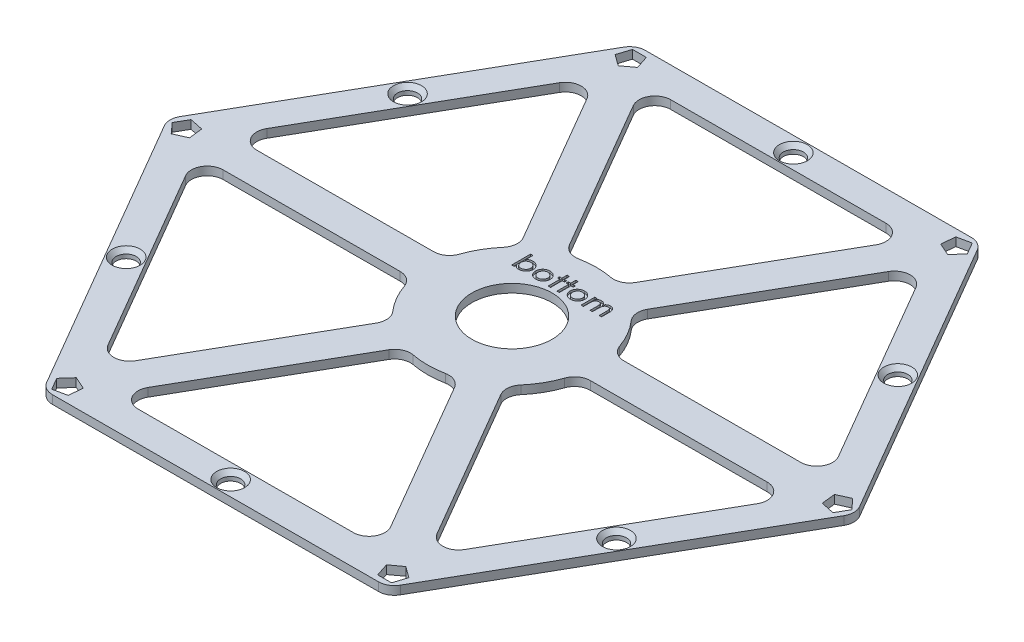
from build123d import *

# Parameters (mm, degrees)
SKETCH1_R           = 1.9
BOSS_EXTRUDE1_DEPTH = 1.6
FILLET1_R           = 3
FILLET2_R           = 3
SKETCH3_R           = 7.6
CUT_EXTRUDE1_DEPTH  = 10
CUT_EXTRUDE2_DEPTH  = 0.4
CHAMFER1_SIZE       = 0.75
CHAMFER1_SIZE2      = 0.832959386
SCALE1_SCALE        = 1.15


with BuildPart() as part:
    # Sketch1 → Boss-Extrude1 (new body)
    with BuildSketch(Plane(origin=(0, 0, 0), x_dir=(1, 0, 0), z_dir=(0, 1, 0))):
        Polygon((-32.670459977, 56.192891409), (-64.999701461, -0.197002589), (-32.329241484, -56.389893998), (32.670459977, -56.192891409), (64.999701461, 0.197002589), (32.329241484, 56.389893998), align=None)
        with Locations(Location((-46.355761236, 26.576510309, 0), (0, 0, 270))):
            Circle(SKETCH1_R, mode=Mode.SUBTRACT)
        with Locations(Location((-0.161947547, 53.433521997, 0), (0, 0, 270))):
            Circle(SKETCH1_R, mode=Mode.SUBTRACT)
        with Locations(Location((46.19381369, 26.857011688, 0), (0, 0, 270))):
            Circle(SKETCH1_R, mode=Mode.SUBTRACT)
        with Locations(Location((46.355761236, -26.576510309, 0), (0, 0, 270))):
            Circle(SKETCH1_R, mode=Mode.SUBTRACT)
        with Locations(Location((0.161947547, -53.433521997, 0), (0, 0, 270))):
            Circle(SKETCH1_R, mode=Mode.SUBTRACT)
        with Locations(Location((-46.19381369, -26.857011688, 0), (0, 0, 270))):
            Circle(SKETCH1_R, mode=Mode.SUBTRACT)
        with BuildLine():
            Line((-31.193440085, 47.277250649), (-56.559443422, 3.032901767))
            Line((-56.559443422, 3.032901767), (-15.685493875, 3.156783473))
            ThreePointArc((-15.685493875, 3.156783473), (-13.880589292, 7.957967134), (-10.649180608, 11.941312842))
            Line((-10.649180608, 11.941312842), (-31.193440085, 47.277250649))
        make_face(mode=Mode.SUBTRACT)
        with BuildLine():
            Line((-56.540020126, -3.375686221), (-30.906291689, -47.465463944))
            Line((-30.906291689, -47.465463944), (-10.576601619, -12.00564443))
            ThreePointArc((-10.576601619, -12.00564443), (-13.832096347, -8.041959379), (-15.666070579, -3.251804515))
            Line((-15.666070579, -3.251804515), (-56.540020126, -3.375686221))
        make_face(mode=Mode.SUBTRACT)
        with BuildLine():
            Line((-25.346580041, -50.65293687), (25.653151733, -50.498365711))
            Line((25.653151733, -50.498365711), (5.108892256, -15.162427903))
            ThreePointArc((5.108892256, -15.162427903), (0.048492945, -15.999926513), (-5.016889971, -15.193117357))
            Line((-5.016889971, -15.193117357), (-25.346580041, -50.65293687))
        make_face(mode=Mode.SUBTRACT)
        with BuildLine():
            Line((31.193440085, -47.277250649), (56.559443422, -3.032901767))
            Line((56.559443422, -3.032901767), (15.685493875, -3.156783473))
            ThreePointArc((15.685493875, -3.156783473), (13.880589292, -7.957967134), (10.649180608, -11.941312842))
            Line((10.649180608, -11.941312842), (31.193440085, -47.277250649))
        make_face(mode=Mode.SUBTRACT)
        with BuildLine():
            Line((56.540020126, 3.375686221), (30.906291689, 47.465463944))
            Line((30.906291689, 47.465463944), (10.576601619, 12.00564443))
            ThreePointArc((10.576601619, 12.00564443), (13.832096347, 8.041959379), (15.666070579, 3.251804515))
            Line((15.666070579, 3.251804515), (56.540020126, 3.375686221))
        make_face(mode=Mode.SUBTRACT)
        with BuildLine():
            Line((25.346580041, 50.65293687), (-25.653151733, 50.498365711))
            Line((-25.653151733, 50.498365711), (-5.108892256, 15.162427903))
            ThreePointArc((-5.108892256, 15.162427903), (-0.048492945, 15.999926513), (5.016889971, 15.193117357))
            Line((5.016889971, 15.193117357), (25.346580041, 50.65293687))
        make_face(mode=Mode.SUBTRACT)
        Polygon((28.764451985, 52.408726504), (31.157091964, 51.352131998), (32.90133947, 53.301162184), (31.586703733, 55.562323589), (29.029966659, 55.010768007), align=None, mode=Mode.SUBTRACT)
        Polygon((-31.00506254, 51.115109397), (-28.893704867, 52.658899148), (-29.709490768, 55.143976891), (-32.325031855, 55.136049649), (-33.125739246, 52.646072601), align=None, mode=Mode.SUBTRACT)
        Polygon((59.769514525, 1.293617108), (60.050796831, -1.30676715), (62.610830237, -1.842814707), (63.911735588, 0.42627394), (62.155705905, 2.364695405), align=None, mode=Mode.SUBTRACT)
        Polygon((31.00506254, -51.115109397), (28.893704867, -52.658899148), (29.709490768, -55.143976891), (32.325031855, -55.136049649), (33.125739246, -52.646072601), align=None, mode=Mode.SUBTRACT)
        Polygon((-28.764451985, -52.408726504), (-31.157091964, -51.352131998), (-32.90133947, -53.301162184), (-31.586703733, -55.562323589), (-29.029966659, -55.010768007), align=None, mode=Mode.SUBTRACT)
        Polygon((-59.769514525, -1.293617108), (-60.050796831, 1.30676715), (-62.610830237, 1.842814707), (-63.911735588, -0.42627394), (-62.155705905, -2.364695405), align=None, mode=Mode.SUBTRACT)
    extrude(amount=BOSS_EXTRUDE1_DEPTH)

    # Fillet1
    fillet1_edges = [part.edges().sort_by_distance(p)[0] for p in [
        (32.329241484, 0.8, -56.389893998),
        (64.999701461, 0.8, -0.197002589),
        (32.670459977, 0.8, 56.192891409),
        (-32.329241484, 0.8, 56.389893998),
        (-64.999701461, 0.8, 0.197002589),
        (-32.670459977, 0.8, -56.192891409),
    ]]
    fillet(fillet1_edges, radius=FILLET1_R)

    # Fillet2
    fillet2_edges = [part.edges().sort_by_distance(p)[0] for p in [
        (-25.653151733, 0.8, -50.498365711),
        (-5.108892256, 0.8, -15.162427903),
        (5.016889971, 0.8, -15.193117357),
        (25.346580041, 0.8, -50.65293687),
        (30.906291689, 0.8, -47.465463944),
        (10.576601619, 0.8, -12.00564443),
        (15.666070579, 0.8, -3.251804515),
        (56.540020126, 0.8, -3.375686221),
        (56.559443422, 0.8, 3.032901767),
        (15.685493875, 0.8, 3.156783473),
        (10.649180608, 0.8, 11.941312842),
        (31.193440085, 0.8, 47.277250649),
        (25.653151733, 0.8, 50.498365711),
        (5.108892256, 0.8, 15.162427903),
        (-5.016889971, 0.8, 15.193117357),
        (-25.346580041, 0.8, 50.65293687),
        (-10.649180608, 0.8, -11.941312842),
        (-31.193440085, 0.8, -47.277250649),
        (-30.906291689, 0.8, 47.465463944),
        (-10.576601619, 0.8, 12.00564443),
        (-15.666070579, 0.8, 3.251804515),
        (-56.540020126, 0.8, 3.375686221),
        (-56.559443422, 0.8, -3.032901767),
        (-15.685493875, 0.8, -3.156783473),
    ]]
    fillet(fillet2_edges, radius=FILLET2_R)

    # Sketch3 → Cut-Extrude1 (cut)
    with BuildSketch(Plane(origin=(0, 3.6, 0), x_dir=(1, 0, 0), z_dir=(0, 1, 0))):
        with Locations(Location((0, 0, 0), (0, 0, 270))):
            Circle(SKETCH3_R)
    extrude(amount=-CUT_EXTRUDE1_DEPTH, mode=Mode.SUBTRACT)

    # Sketch4 → Cut-Extrude2 (cut)
    # profile 1 of 6: a face of its own
    with BuildSketch(Plane(origin=(0, 1.6, 0), x_dir=(1, 0, 0), z_dir=(0, 1, 0))):
        with BuildLine():
            Line((-8.411608084, 8.345898604), (-8.411608084, 11.935642194))
            Line((-8.411608084, 11.935642194), (-7.962890136, 11.935642194))
            Line((-7.962890136, 11.935642194), (-7.962890136, 10.494135784))
            add(Edge.make_bspline(
                [(-7.962890136, 10.494135784), (-7.955236413, 10.514016076), (-7.940050548, 10.553460861), (-7.908001003, 10.608137128), (-7.872828628, 10.660474453), (-7.8305456, 10.70829229), (-7.783899458, 10.75350831), (-7.730525769, 10.793762374), (-7.673098726, 10.832450824), (-7.587400929, 10.876262859), (-7.474461069, 10.924327186), (-7.331016198, 10.963509367), (-7.18208645, 10.989512185), (-7.080524486, 10.992047952), (-7.028995905, 10.993334501)],
                knots=[0, 0, 0, 0, 0.680701944, 1.350590845, 2.022856059, 2.696285514, 3.389369315, 4.098573498, 4.833009766, 5.602602626, 7.175179895, 8.752393662, 10.352291167, 12, 12, 12, 12], degree=3))
            add(Edge.make_bspline(
                [(-7.028995905, 10.993334501), (-6.9805481, 10.992196958), (-6.885374184, 10.989962295), (-6.74580311, 10.970117535), (-6.611662578, 10.939920218), (-6.483880558, 10.895168673), (-6.361338558, 10.839080896), (-6.245582509, 10.768876522), (-6.134811002, 10.687483128), (-6.032176045, 10.593780646), (-5.938058286, 10.49244227), (-5.855451001, 10.384793184), (-5.786022677, 10.272358076), (-5.728275465, 10.155681587), (-5.684204409, 10.03402511), (-5.652558569, 9.907663073), (-5.63309031, 9.776793107), (-5.630743407, 9.687912418), (-5.629556802, 9.642973925)],
                knots=[0, 0, 0, 0, 1.074668416, 2.111146229, 3.122705793, 4.121647212, 5.110247569, 6.108286401, 7.120763069, 8.156293076, 9.187671081, 10.186679824, 11.162571933, 12.115944014, 13.070894994, 14.028209439, 15.003053446, 16, 16, 16, 16], degree=3))
            add(Edge.make_bspline(
                [(-5.629556802, 9.642973925), (-5.630764102, 9.598507508), (-5.633151773, 9.510566477), (-5.652325961, 9.380955144), (-5.685127825, 9.256224479), (-5.729118472, 9.135343217), (-5.787345611, 9.019349207), (-5.857496659, 8.907167769), (-5.941910018, 8.800717739), (-6.036331073, 8.698847157), (-6.140193368, 8.60595262), (-6.251364774, 8.524249258), (-6.368471162, 8.455610081), (-6.491553758, 8.399093841), (-6.619895794, 8.35459109), (-6.754652919, 8.324065618), (-6.894739278, 8.304497522), (-6.990368107, 8.302193817), (-7.03881161, 8.301026809)],
                knots=[0, 0, 0, 0, 0.986702435, 1.951396945, 2.900058972, 3.845382255, 4.801165494, 5.775518569, 6.776892958, 7.811922902, 8.855290601, 9.864814267, 10.869247359, 11.862676509, 12.866640669, 13.878321069, 14.925203209, 16, 16, 16, 16], degree=3))
            add(Edge.make_bspline(
                [(-7.03881161, 8.301026809), (-7.091489282, 8.30239133), (-7.194837166, 8.305068371), (-7.346118592, 8.329632771), (-7.489799745, 8.369623653), (-7.603187317, 8.415689184), (-7.687752577, 8.459946374), (-7.744921651, 8.498206871), (-7.796478123, 8.540128517), (-7.84145983, 8.586837295), (-7.880935994, 8.636845341), (-7.915242887, 8.690537151), (-7.942485502, 8.748948314), (-7.956049622, 8.790026326), (-7.962890136, 8.810742354)],
                knots=[0, 0, 0, 0, 1.675473688, 3.287097786, 4.862496695, 6.413566731, 7.17220872, 7.8962647, 8.599074997, 9.282855083, 9.955419216, 10.623982288, 11.306061326, 12, 12, 12, 12], degree=3))
            Line((-7.962890136, 8.810742354), (-7.962890136, 8.345898604))
            Line((-7.962890136, 8.345898604), (-8.411608084, 8.345898604))
        make_face()
        with BuildLine():
            add(Edge.make_bspline(
                [(-7.044420584, 8.704872963), (-7.001302044, 8.706276256), (-6.916295741, 8.709042786), (-6.791807417, 8.73341886), (-6.672171635, 8.770788001), (-6.559700323, 8.825318111), (-6.454557255, 8.892405478), (-6.360297828, 8.973487653), (-6.277277835, 9.067136243), (-6.207384282, 9.171988548), (-6.149563982, 9.283883924), (-6.109094996, 9.401062254), (-6.083135854, 9.521013089), (-6.079900797, 9.602177858), (-6.078274751, 9.642973925)],
                knots=[0, 0, 0, 0, 1.03659623, 2.043603792, 3.041335506, 4.044961332, 5.041741677, 6.034771129, 7.026717184, 8.043662561, 9.059736814, 10.048601465, 11.019163284, 12, 12, 12, 12], degree=3))
            add(Edge.make_bspline(
                [(-6.078274751, 9.642973925), (-6.079917076, 9.68376458), (-6.083184521, 9.764918583), (-6.108917546, 9.885026319), (-6.15047735, 10.00225678), (-6.208938246, 10.114805821), (-6.279392979, 10.220867284), (-6.362861925, 10.315960332), (-6.458374312, 10.397849127), (-6.564085345, 10.466062005), (-6.676637403, 10.520809691), (-6.794154215, 10.560347551), (-6.915529504, 10.585304017), (-6.998028008, 10.588088273), (-7.039512732, 10.589488348)],
                knots=[0, 0, 0, 0, 0.981888717, 1.953491515, 2.945287927, 3.970026407, 5.000547576, 6.005722906, 7.007756092, 8.02117424, 9.028318265, 10.014586984, 11.001626628, 12, 12, 12, 12], degree=3))
            add(Edge.make_bspline(
                [(-7.039512732, 10.589488348), (-7.078628508, 10.587869474), (-7.156753083, 10.584636153), (-7.27300269, 10.562581368), (-7.386273257, 10.523733359), (-7.496477371, 10.472470361), (-7.599699479, 10.408097136), (-7.692325322, 10.330358224), (-7.773210954, 10.241109281), (-7.841546902, 10.140397288), (-7.895471901, 10.029824455), (-7.935264054, 9.91094013), (-7.958656452, 9.783648144), (-7.961458159, 9.696122515), (-7.962890136, 9.651387386)],
                knots=[0, 0, 0, 0, 0.959373566, 1.916123333, 2.889556708, 3.889679944, 4.891657799, 5.864145535, 6.846266176, 7.836782301, 8.839170007, 9.854294299, 10.903310711, 12, 12, 12, 12], degree=3))
            add(Edge.make_bspline(
                [(-7.962890136, 9.651387386), (-7.962124604, 9.617223615), (-7.960624778, 9.550290137), (-7.947617, 9.452428894), (-7.92699979, 9.359239941), (-7.896409803, 9.271360413), (-7.858346534, 9.187924599), (-7.812318708, 9.108880626), (-7.755929524, 9.035962176), (-7.693537116, 8.967413229), (-7.624415196, 8.906183314), (-7.551158759, 8.852841871), (-7.475221398, 8.806669924), (-7.395522079, 8.769388288), (-7.312357002, 8.740391688), (-7.225804855, 8.720472552), (-7.136211817, 8.707130004), (-7.075319083, 8.705632722), (-7.044420584, 8.704872963)],
                knots=[0, 0, 0, 0, 1.112739128, 2.180072519, 3.210895806, 4.217526677, 5.205727299, 6.195686808, 7.19023402, 8.203468079, 9.212141938, 10.193039035, 11.152931012, 12.103382444, 13.054657187, 14.016992754, 14.993772461, 16, 16, 16, 16], degree=3))
        make_face(mode=Mode.SUBTRACT)
    # profile 2 of 6: a face of its own
    with BuildSketch(Plane(origin=(0, 1.6, 0), x_dir=(1, 0, 0), z_dir=(0, 1, 0))):
        with BuildLine():
            add(Edge.make_bspline(
                [(-3.810846866, 10.993334501), (-3.758906923, 10.991912133), (-3.657218318, 10.989127403), (-3.508421078, 10.969535512), (-3.367122986, 10.935495262), (-3.232919071, 10.888904972), (-3.10636165, 10.827865192), (-2.987134626, 10.754017599), (-2.875664267, 10.665926259), (-2.808518692, 10.598380182), (-2.774588854, 10.564247963)],
                knots=[0, 0, 0, 0, 1.078775739, 2.112039281, 3.110494877, 4.093081892, 5.057110616, 6.022958758, 7.000966324, 8, 8, 8, 8], degree=3))
            add(Edge.make_bspline(
                [(-2.774588854, 10.564247963), (-2.744499992, 10.53041689), (-2.685342943, 10.463902362), (-2.60890563, 10.356611271), (-2.543809882, 10.246242043), (-2.491145674, 10.131962604), (-2.449168495, 10.014295532), (-2.420057018, 9.892775882), (-2.401724809, 9.767633549), (-2.399774586, 9.68300183), (-2.398787572, 9.640169437)],
                knots=[0, 0, 0, 0, 1.062178036, 2.088324843, 3.086640365, 4.066023852, 5.037709567, 6.014384934, 6.995073642, 8, 8, 8, 8], degree=3))
            add(Edge.make_bspline(
                [(-2.398787572, 9.640169437), (-2.400021196, 9.597100699), (-2.402466069, 9.511744447), (-2.421390786, 9.385655066), (-2.45132057, 9.262924209), (-2.494375386, 9.14411218), (-2.549785926, 9.029090065), (-2.616261686, 8.917158191), (-2.696410117, 8.809806345), (-2.786525019, 8.706723267), (-2.886668191, 8.611624708), (-2.995957593, 8.528366828), (-3.113053425, 8.457908502), (-3.237744248, 8.399911576), (-3.370624732, 8.356087143), (-3.510407632, 8.323632412), (-3.658171372, 8.304465798), (-3.75914102, 8.302191474), (-3.810846866, 8.301026809)],
                knots=[0, 0, 0, 0, 0.952871876, 1.888459614, 2.815544184, 3.744891397, 4.679563604, 5.637601804, 6.621431805, 7.640342292, 8.664856555, 9.672479278, 10.67487095, 11.683873433, 12.709444777, 13.765907845, 14.855937143, 16, 16, 16, 16], degree=3))
            add(Edge.make_bspline(
                [(-3.810846866, 8.301026809), (-3.860228247, 8.302161001), (-3.957030049, 8.304384347), (-4.098487088, 8.324122792), (-4.233376791, 8.354245887), (-4.360715446, 8.399060238), (-4.481552063, 8.455101463), (-4.5950783, 8.524609461), (-4.702168582, 8.605930581), (-4.800029351, 8.700019522), (-4.889226605, 8.801168508), (-4.966648395, 8.90855158), (-5.033238429, 9.019672181), (-5.087375168, 9.13547023), (-5.12886093, 9.255904094), (-5.159236498, 9.379979901), (-5.176974579, 9.508782922), (-5.179538147, 9.595945032), (-5.180838854, 9.640169437)],
                knots=[0, 0, 0, 0, 1.108842573, 2.173652473, 3.202745058, 4.208988794, 5.200203338, 6.189803525, 7.193715926, 8.215010613, 9.234454675, 10.219573757, 11.184848795, 12.140854958, 13.08565054, 14.042002664, 15.006549187, 16, 16, 16, 16], degree=3))
            add(Edge.make_bspline(
                [(-5.180838854, 9.640169437), (-5.179779491, 9.683924019), (-5.177692337, 9.770129204), (-5.160583235, 9.897236566), (-5.13155439, 10.019368128), (-5.092421441, 10.137512286), (-5.040746613, 10.250769472), (-4.977923329, 10.359778762), (-4.904519708, 10.464942641), (-4.847300532, 10.529494205), (-4.818358886, 10.562144598)],
                knots=[0, 0, 0, 0, 1.034079547, 2.037341334, 3.024980457, 3.998111168, 4.974764182, 5.962233312, 6.969290918, 8, 8, 8, 8], degree=3))
            add(Edge.make_bspline(
                [(-4.818358886, 10.562144598), (-4.784689858, 10.59653832), (-4.718313306, 10.664343568), (-4.607830337, 10.752252957), (-4.491265069, 10.827207452), (-4.367444777, 10.887478911), (-4.237814524, 10.935905417), (-4.101100645, 10.96928076), (-3.95796562, 10.989121733), (-3.860456309, 10.991913927), (-3.810846866, 10.993334501)],
                knots=[0, 0, 0, 0, 1.021997278, 2.014808882, 2.992991082, 3.961403697, 4.935644248, 5.92819495, 6.945935601, 8, 8, 8, 8], degree=3))
        make_face()
        with BuildLine():
            add(Edge.make_bspline(
                [(-3.81224911, 10.589488348), (-3.842208448, 10.588690021), (-3.901694312, 10.587104902), (-3.98931212, 10.574133994), (-4.074472746, 10.553158842), (-4.156241693, 10.522706486), (-4.235853189, 10.484650232), (-4.311969274, 10.437249602), (-4.386305396, 10.382428315), (-4.456155361, 10.318946741), (-4.521143784, 10.249837773), (-4.577450997, 10.174891397), (-4.625620243, 10.096208946), (-4.664196765, 10.012797251), (-4.694676734, 9.925222541), (-4.716004023, 9.833316548), (-4.730060946, 9.737122523), (-4.731424841, 9.671537409), (-4.732120905, 9.638066072)],
                knots=[0, 0, 0, 0, 0.976916649, 1.939720157, 2.882730922, 3.833047911, 4.780976627, 5.756404754, 6.753607, 7.790049989, 8.831165002, 9.84360893, 10.842529111, 11.835057585, 12.835634664, 13.861933882, 14.908838789, 16, 16, 16, 16], degree=3))
            add(Edge.make_bspline(
                [(-4.732120905, 9.638066072), (-4.73052718, 9.594472931), (-4.727390688, 9.508680471), (-4.70176101, 9.383016314), (-4.66108534, 9.262919005), (-4.604293674, 9.149955625), (-4.534867616, 9.046607289), (-4.453940704, 8.956131463), (-4.364607243, 8.877807951), (-4.265142533, 8.814911198), (-4.158956833, 8.765682534), (-4.047487291, 8.730636287), (-3.931362469, 8.708733055), (-3.852309895, 8.706171208), (-3.81224911, 8.704872963)],
                knots=[0, 0, 0, 0, 1.073737222, 2.11314337, 3.147909503, 4.191315005, 5.220292011, 6.207728104, 7.175628903, 8.139268678, 9.098074859, 10.052770626, 11.013219503, 12, 12, 12, 12], degree=3))
            add(Edge.make_bspline(
                [(-3.81224911, 8.704872963), (-3.768912805, 8.706353659), (-3.683516324, 8.709271448), (-3.558441445, 8.732461672), (-3.438995211, 8.769696243), (-3.326014595, 8.821590368), (-3.221162675, 8.887333128), (-3.127403044, 8.967122176), (-3.045230795, 9.059634742), (-2.97487063, 9.162754306), (-2.918051784, 9.274639565), (-2.877258921, 9.392062841), (-2.852515846, 9.513873574), (-2.849188384, 9.596352401), (-2.84750552, 9.638066072)],
                knots=[0, 0, 0, 0, 1.042880454, 2.055051067, 3.051726387, 4.048830532, 5.040201766, 6.022282375, 7.002717173, 8.011000956, 9.020163719, 10.014978664, 10.996075346, 12, 12, 12, 12], degree=3))
            add(Edge.make_bspline(
                [(-2.84750552, 9.638066072), (-2.848236744, 9.670365255), (-2.849679181, 9.73407972), (-2.863446501, 9.827821313), (-2.885790597, 9.91808672), (-2.917542001, 10.004472794), (-2.957750317, 10.087280044), (-3.007221696, 10.166155458), (-3.065780869, 10.241475008), (-3.13253705, 10.312019667), (-3.204901287, 10.376882332), (-3.281363504, 10.434163593), (-3.361766785, 10.481737702), (-3.444996728, 10.521828866), (-3.532227373, 10.551620147), (-3.622562251, 10.573445662), (-3.716232079, 10.587343284), (-3.779948789, 10.588766744), (-3.81224911, 10.589488348)],
                knots=[0, 0, 0, 0, 1.02928639, 2.030405262, 3.013559112, 3.98951401, 4.959304921, 5.943474834, 6.952548865, 7.996299005, 9.035918103, 10.047849461, 11.03697177, 12.01024899, 12.98822153, 13.969594738, 14.97071361, 16, 16, 16, 16], degree=3))
        make_face(mode=Mode.SUBTRACT)
    # profile 3 of 6: a face of its own
    with BuildSketch(Plane(origin=(0, 1.6, 0), x_dir=(1, 0, 0), z_dir=(0, 1, 0))):
        Polygon((-1.501351674, 11.935642194), (-1.052633725, 11.935642194), (-1.052633725, 10.948462707), (-0.603915777, 10.948462707), (-0.603915777, 10.544616553), (-1.052633725, 10.544616553), (-1.052633725, 8.345898604), (-1.501351674, 8.345898604), (-1.501351674, 10.544616553), (-1.950069623, 10.544616553), (-1.950069623, 10.948462707), (-1.501351674, 10.948462707), align=None)
    # profile 4 of 6: a face of its own
    with BuildSketch(Plane(origin=(0, 1.6, 0), x_dir=(1, 0, 0), z_dir=(0, 1, 0))):
        Polygon((0.158904736, 11.935642194), (0.607622685, 11.935642194), (0.607622685, 10.948462707), (1.056340634, 10.948462707), (1.056340634, 10.544616553), (0.607622685, 10.544616553), (0.607622685, 8.345898604), (0.158904736, 8.345898604), (0.158904736, 10.544616553), (-0.289813213, 10.544616553), (-0.289813213, 10.948462707), (0.158904736, 10.948462707), align=None)
    # profile 5 of 6: a face of its own
    with BuildSketch(Plane(origin=(0, 1.6, 0), x_dir=(1, 0, 0), z_dir=(0, 1, 0))):
        with BuildLine():
            add(Edge.make_bspline(
                [(2.740435185, 10.993334501), (2.792375128, 10.991912133), (2.894063733, 10.989127403), (3.042860973, 10.969535512), (3.184159065, 10.935495262), (3.31836298, 10.888904972), (3.444920401, 10.827865192), (3.564147425, 10.754017599), (3.675617785, 10.665926259), (3.742763359, 10.598380182), (3.776693198, 10.564247963)],
                knots=[0, 0, 0, 0, 1.078775739, 2.112039281, 3.110494877, 4.093081892, 5.057110616, 6.022958758, 7.000966324, 8, 8, 8, 8], degree=3))
            add(Edge.make_bspline(
                [(3.776693198, 10.564247963), (3.806782059, 10.53041689), (3.865939108, 10.463902362), (3.942376421, 10.356611271), (4.00747217, 10.246242043), (4.060136378, 10.131962604), (4.102113556, 10.014295532), (4.131225034, 9.892775882), (4.149557242, 9.767633549), (4.151507465, 9.68300183), (4.15249448, 9.640169437)],
                knots=[0, 0, 0, 0, 1.062178036, 2.088324843, 3.086640365, 4.066023852, 5.037709567, 6.014384934, 6.995073642, 8, 8, 8, 8], degree=3))
            add(Edge.make_bspline(
                [(4.15249448, 9.640169437), (4.151260855, 9.597100699), (4.148815983, 9.511744447), (4.129891266, 9.385655066), (4.099961481, 9.262924209), (4.056906666, 9.14411218), (4.001496125, 9.029090065), (3.935020365, 8.917158191), (3.854871934, 8.809806345), (3.764757033, 8.706723267), (3.66461386, 8.611624708), (3.555324458, 8.528366828), (3.438228627, 8.457908502), (3.313537803, 8.399911576), (3.18065732, 8.356087143), (3.040874419, 8.323632412), (2.89311068, 8.304465798), (2.792141031, 8.302191474), (2.740435185, 8.301026809)],
                knots=[0, 0, 0, 0, 0.952871876, 1.888459614, 2.815544184, 3.744891397, 4.679563604, 5.637601804, 6.621431805, 7.640342292, 8.664856555, 9.672479278, 10.67487095, 11.683873433, 12.709444777, 13.765907845, 14.855937143, 16, 16, 16, 16], degree=3))
            add(Edge.make_bspline(
                [(2.740435185, 8.301026809), (2.691053805, 8.302161001), (2.594252003, 8.304384347), (2.452794963, 8.324122792), (2.317905261, 8.354245887), (2.190566605, 8.399060238), (2.069729988, 8.455101463), (1.956203751, 8.524609461), (1.849113469, 8.605930581), (1.751252701, 8.700019522), (1.662055447, 8.801168508), (1.584633657, 8.90855158), (1.518043622, 9.019672181), (1.463906883, 9.13547023), (1.422421122, 9.255904094), (1.392045554, 9.379979901), (1.374307472, 9.508782922), (1.371743904, 9.595945032), (1.370443198, 9.640169437)],
                knots=[0, 0, 0, 0, 1.108842573, 2.173652473, 3.202745058, 4.208988794, 5.200203338, 6.189803525, 7.193715926, 8.215010613, 9.234454675, 10.219573757, 11.184848795, 12.140854958, 13.08565054, 14.042002664, 15.006549187, 16, 16, 16, 16], degree=3))
            add(Edge.make_bspline(
                [(1.370443198, 9.640169437), (1.37150256, 9.683924019), (1.373589715, 9.770129204), (1.390698816, 9.897236566), (1.419727662, 10.019368128), (1.45886061, 10.137512286), (1.510535438, 10.250769472), (1.573358722, 10.359778762), (1.646762344, 10.464942641), (1.703981519, 10.529494205), (1.732923166, 10.562144598)],
                knots=[0, 0, 0, 0, 1.034079547, 2.037341334, 3.024980457, 3.998111168, 4.974764182, 5.962233312, 6.969290918, 8, 8, 8, 8], degree=3))
            add(Edge.make_bspline(
                [(1.732923166, 10.562144598), (1.766592193, 10.59653832), (1.832968745, 10.664343568), (1.943451714, 10.752252957), (2.060016983, 10.827207452), (2.183837275, 10.887478911), (2.313467528, 10.935905417), (2.450181406, 10.96928076), (2.593316431, 10.989121733), (2.690825742, 10.991913927), (2.740435185, 10.993334501)],
                knots=[0, 0, 0, 0, 1.021997278, 2.014808882, 2.992991082, 3.961403697, 4.935644248, 5.92819495, 6.945935601, 8, 8, 8, 8], degree=3))
        make_face()
        with BuildLine():
            add(Edge.make_bspline(
                [(2.739032941, 10.589488348), (2.709073604, 10.588690021), (2.649587739, 10.587104902), (2.561969932, 10.574133994), (2.476809306, 10.553158842), (2.395040358, 10.522706486), (2.315428862, 10.484650232), (2.239312777, 10.437249602), (2.164976656, 10.382428315), (2.09512669, 10.318946741), (2.030138267, 10.249837773), (1.973831054, 10.174891397), (1.925661808, 10.096208946), (1.887085286, 10.012797251), (1.856605318, 9.925222541), (1.835278028, 9.833316548), (1.821221106, 9.737122523), (1.81985721, 9.671537409), (1.819161146, 9.638066072)],
                knots=[0, 0, 0, 0, 0.976916649, 1.939720157, 2.882730922, 3.833047911, 4.780976627, 5.756404754, 6.753607, 7.790049989, 8.831165002, 9.84360893, 10.842529111, 11.835057585, 12.835634664, 13.861933882, 14.908838789, 16, 16, 16, 16], degree=3))
            add(Edge.make_bspline(
                [(1.819161146, 9.638066072), (1.820754871, 9.594472931), (1.823891363, 9.508680471), (1.849521041, 9.383016314), (1.890196712, 9.262919005), (1.946988378, 9.149955625), (2.016414436, 9.046607289), (2.097341347, 8.956131463), (2.186674808, 8.877807951), (2.286139518, 8.814911198), (2.392325218, 8.765682534), (2.50379476, 8.730636287), (2.619919582, 8.708733055), (2.698972156, 8.706171208), (2.739032941, 8.704872963)],
                knots=[0, 0, 0, 0, 1.073737222, 2.11314337, 3.147909503, 4.191315005, 5.220292011, 6.207728104, 7.175628903, 8.139268678, 9.098074859, 10.052770626, 11.013219503, 12, 12, 12, 12], degree=3))
            add(Edge.make_bspline(
                [(2.739032941, 8.704872963), (2.782369247, 8.706353659), (2.867765727, 8.709271448), (2.992840606, 8.732461672), (3.112286841, 8.769696243), (3.225267456, 8.821590368), (3.330119377, 8.887333128), (3.423879007, 8.967122176), (3.506051256, 9.059634742), (3.576411421, 9.162754306), (3.633230267, 9.274639565), (3.67402313, 9.392062841), (3.698766205, 9.513873574), (3.702093667, 9.596352401), (3.703776531, 9.638066072)],
                knots=[0, 0, 0, 0, 1.042880454, 2.055051067, 3.051726387, 4.048830532, 5.040201766, 6.022282375, 7.002717173, 8.011000956, 9.020163719, 10.014978664, 10.996075346, 12, 12, 12, 12], degree=3))
            add(Edge.make_bspline(
                [(3.703776531, 9.638066072), (3.703045307, 9.670365255), (3.70160287, 9.73407972), (3.68783555, 9.827821313), (3.665491454, 9.91808672), (3.63374005, 10.004472794), (3.593531734, 10.087280044), (3.544060355, 10.166155458), (3.485501183, 10.241475008), (3.418745001, 10.312019667), (3.346380765, 10.376882332), (3.269918547, 10.434163593), (3.189515266, 10.481737702), (3.106285323, 10.521828866), (3.019054678, 10.551620147), (2.928719801, 10.573445662), (2.835049972, 10.587343284), (2.771333262, 10.588766744), (2.739032941, 10.589488348)],
                knots=[0, 0, 0, 0, 1.02928639, 2.030405262, 3.013559112, 3.98951401, 4.959304921, 5.943474834, 6.952548865, 7.996299005, 9.035918103, 10.047849461, 11.03697177, 12.01024899, 12.98822153, 13.969594738, 14.97071361, 16, 16, 16, 16], degree=3))
        make_face(mode=Mode.SUBTRACT)
    # profile 6 of 6: a face of its own
    with BuildSketch(Plane(origin=(0, 1.6, 0), x_dir=(1, 0, 0), z_dir=(0, 1, 0))):
        with BuildLine():
            Line((4.735827813, 10.948462707), (5.184545762, 10.948462707))
            Line((5.184545762, 10.948462707), (5.184545762, 10.511663828))
            add(Edge.make_bspline(
                [(5.184545762, 10.511663828), (5.188855317, 10.530460011), (5.19726395, 10.567134375), (5.215779941, 10.619470162), (5.238400294, 10.667865528), (5.264145654, 10.713476863), (5.295430394, 10.754534966), (5.32965145, 10.793118097), (5.369270442, 10.826639939), (5.39797389, 10.846118067), (5.412410345, 10.85591463)],
                knots=[0, 0, 0, 0, 1.08898891, 2.124791909, 3.129224238, 4.105481065, 5.077441123, 6.040388005, 7.014409297, 8, 8, 8, 8], degree=3))
            add(Edge.make_bspline(
                [(5.412410345, 10.85591463), (5.455863932, 10.877201365), (5.541661448, 10.919231243), (5.677359111, 10.960981285), (5.814646589, 10.988797629), (5.907265535, 10.991820005), (5.953676371, 10.993334501)],
                knots=[0, 0, 0, 0, 1.028471117, 2.030678542, 3.013184023, 4, 4, 4, 4], degree=3))
            add(Edge.make_bspline(
                [(5.953676371, 10.993334501), (5.98785733, 10.992463983), (6.055640806, 10.990737679), (6.156007136, 10.974643085), (6.253484113, 10.948771731), (6.347152403, 10.913065439), (6.434535302, 10.869254187), (6.514317875, 10.819749397), (6.584545863, 10.763628539), (6.646122279, 10.702180895), (6.697288097, 10.633289465), (6.737635604, 10.557852909), (6.766259206, 10.474931121), (6.775999742, 10.416737896), (6.781000089, 10.386864149)],
                knots=[0, 0, 0, 0, 1.099015544, 2.179432478, 3.260947688, 4.338981182, 5.398181099, 6.40160478, 7.353922011, 8.284349489, 9.192639792, 10.104191918, 11.026778618, 12, 12, 12, 12], degree=3))
            add(Edge.make_bspline(
                [(6.781000089, 10.386864149), (6.789098824, 10.40988599), (6.805113306, 10.455409499), (6.834397994, 10.520993685), (6.869872271, 10.58220851), (6.90998907, 10.639871914), (6.954757742, 10.694338861), (7.005774807, 10.743713364), (7.060426271, 10.79075087), (7.120693952, 10.831983505), (7.183383147, 10.869807672), (7.248067623, 10.902782158), (7.313773197, 10.931042112), (7.381029358, 10.953248322), (7.4489727, 10.971938352), (7.518653222, 10.984509344), (7.589489302, 10.991353792), (7.637056199, 10.992673002), (7.660907941, 10.993334501)],
                knots=[0, 0, 0, 0, 1.024672991, 2.026193794, 3.01103273, 3.991165591, 4.973850373, 5.96628909, 6.969107479, 7.9982829, 9.028393851, 10.042340945, 11.044967205, 12.028827566, 13.014448664, 14.002022455, 14.998142625, 16, 16, 16, 16], degree=3))
            add(Edge.make_bspline(
                [(7.660907941, 10.993334501), (7.685233735, 10.993015976), (7.7330566, 10.992389777), (7.803517533, 10.984894372), (7.871764457, 10.973969816), (7.937693511, 10.957921624), (8.001066049, 10.936605766), (8.0621861, 10.911284077), (8.121354982, 10.882106737), (8.19533071, 10.836082902), (8.281566439, 10.77186127), (8.369066162, 10.679140793), (8.442400659, 10.575828278), (8.490047894, 10.479559132), (8.520405011, 10.395077317), (8.540801994, 10.324163558), (8.557194314, 10.246059734), (8.571381658, 10.161188506), (8.581553239, 10.06894436), (8.589082005, 9.969794698), (8.594273933, 9.863414321), (8.594622072, 9.790216061), (8.594802172, 9.752348925)],
                knots=[0, 0, 0, 0, 0.823429448, 1.618806632, 2.396867138, 3.162757021, 3.913573328, 4.658737237, 5.40200746, 6.144476677, 7.607081062, 9.028926194, 10.443018941, 11.88355177, 12.649646081, 13.481287888, 14.380074908, 15.350698398, 16.394246037, 17.521443358, 18.717785893, 20, 20, 20, 20], degree=3))
            Line((8.594802172, 9.752348925), (8.594802172, 8.345898604))
            Line((8.594802172, 8.345898604), (8.146084223, 8.345898604))
            Line((8.146084223, 8.345898604), (8.146084223, 9.750946681))
            add(Edge.make_bspline(
                [(8.146084223, 9.750946681), (8.146028044, 9.782266145), (8.145920271, 9.842348469), (8.142958371, 9.928369132), (8.138797933, 10.00644467), (8.133551772, 10.076647984), (8.125799029, 10.139081447), (8.116751537, 10.193821009), (8.106882947, 10.240916595), (8.089882492, 10.292401352), (8.063320681, 10.348678128), (8.021827037, 10.408783098), (7.970825245, 10.461689466), (7.910968696, 10.507145872), (7.843799238, 10.54485836), (7.768890509, 10.570293084), (7.688318618, 10.587318052), (7.632255401, 10.588751149), (7.603415954, 10.589488348)],
                knots=[0, 0, 0, 0, 1.305376404, 2.504195096, 3.587062772, 4.564309401, 5.437885818, 6.208191464, 6.877018247, 7.440755119, 8.464755235, 9.459136026, 10.471907885, 11.51427718, 12.582498913, 13.666986569, 14.799875944, 16, 16, 16, 16], degree=3))
            add(Edge.make_bspline(
                [(7.603415954, 10.589488348), (7.571282242, 10.587921564), (7.506938361, 10.58478427), (7.411910361, 10.561817912), (7.320682187, 10.522115729), (7.233115958, 10.469183823), (7.152725239, 10.401868192), (7.081519722, 10.32185462), (7.022772413, 10.228306313), (6.981286191, 10.141357436), (6.954503643, 10.061854766), (6.937592678, 9.991370033), (6.921815207, 9.911468068), (6.910755612, 9.821442222), (6.900386164, 9.721685377), (6.894945494, 9.611933057), (6.89029507, 9.492272434), (6.889886715, 9.409272579), (6.889673967, 9.366030816)],
                knots=[0, 0, 0, 0, 0.96585306, 1.934004254, 2.919496243, 3.947541218, 5.000269242, 6.060662749, 7.154254566, 8.311133038, 8.948925841, 9.673294331, 10.489200144, 11.396606791, 12.399336697, 13.504450846, 14.699853812, 16, 16, 16, 16], degree=3))
            Line((6.889673967, 9.366030816), (6.889673967, 8.345898604))
            Line((6.889673967, 8.345898604), (6.440956018, 8.345898604))
            Line((6.440956018, 8.345898604), (6.440956018, 9.666110944))
            add(Edge.make_bspline(
                [(6.440956018, 9.666110944), (6.440901297, 9.701403149), (6.440796546, 9.768961996), (6.437826939, 9.865731308), (6.433651564, 9.953619344), (6.428480458, 10.032465506), (6.420726436, 10.102147092), (6.411596179, 10.162708561), (6.401874, 10.214487432), (6.38490494, 10.270281533), (6.358963293, 10.331424793), (6.317313622, 10.396208841), (6.265982529, 10.453343609), (6.205410733, 10.501538627), (6.137526245, 10.541010589), (6.062709796, 10.569264068), (5.981805897, 10.586522865), (5.925719496, 10.588481443), (5.896885505, 10.589488348)],
                knots=[0, 0, 0, 0, 1.376972876, 2.63589934, 3.777064908, 4.810071307, 5.718390574, 6.511518754, 7.200035386, 7.771255398, 8.78422519, 9.780850683, 10.762300705, 11.767731362, 12.789080549, 13.813681154, 14.876014565, 16, 16, 16, 16], degree=3))
            add(Edge.make_bspline(
                [(5.896885505, 10.589488348), (5.866155304, 10.587867776), (5.8044117, 10.584611699), (5.71282009, 10.56220725), (5.623500108, 10.523861864), (5.536622829, 10.472518005), (5.455089033, 10.407663226), (5.383419892, 10.328427265), (5.322380469, 10.236401042), (5.280173091, 10.149966742), (5.25242257, 10.072360505), (5.234695018, 10.005406263), (5.218244629, 9.931135621), (5.206133779, 9.848860476), (5.196339097, 9.759052458), (5.189516321, 9.661523215), (5.185275586, 9.556306627), (5.184794649, 9.483589925), (5.184545762, 9.4459587)],
                knots=[0, 0, 0, 0, 0.973948812, 1.956873266, 2.969584629, 4.045778838, 5.147278558, 6.259119363, 7.418022777, 8.637370586, 9.298195669, 10.027900773, 10.831491835, 11.708502133, 12.662464834, 13.694928854, 14.807115174, 16, 16, 16, 16], degree=3))
            Line((5.184545762, 9.4459587), (5.184545762, 8.345898604))
            Line((5.184545762, 8.345898604), (4.735827813, 8.345898604))
            Line((4.735827813, 8.345898604), (4.735827813, 10.948462707))
        make_face()
    extrude(amount=-CUT_EXTRUDE2_DEPTH, mode=Mode.SUBTRACT)

    # Chamfer1
    chamfer1_edges = [part.edges().sort_by_distance(p)[0] for p in [
        (-0.161947547, 1.6, -55.333521997),
        (46.19381369, 1.6, -28.757011688),
        (46.355761236, 1.6, 24.676510309),
        (0.161947547, 1.6, 51.533521997),
        (-46.19381369, 1.6, 24.957011688),
        (-46.355761236, 1.6, -28.476510309),
    ]]
    chamfer1_side = [part.faces().sort_by_distance(p)[0] for p in [
        (-48.686389103, 1.6, -27.912697093),
    ]]
    chamfer(chamfer1_edges, length=CHAMFER1_SIZE, length2=CHAMFER1_SIZE2, reference=chamfer1_side[0])


with BuildPart() as part_1:
    # Scale1: scaled about (0.000315456, 0.797372466, 0.010814179)
    add(part.part.scale(SCALE1_SCALE).moved(Location((-4.7318e-05, -0.11960587, -0.001622127))))


solid = part_1.part
